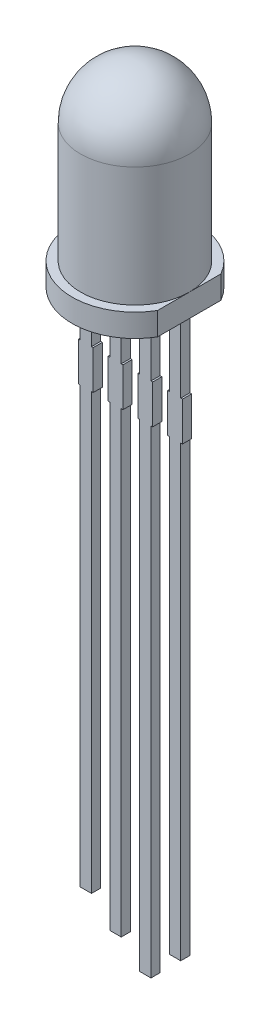
from build123d import *

# Parameters (mm, degrees)
SKETCH2_W           = 0.5
SKETCH2_H           = 24.3
SKETCH2_H_2         = 25.6
SKETCH2_H_3         = 24.7
SKETCH2_H_4         = 23.7
SKETCH2_W_2         = 0.65
SKETCH2_H_5         = 1.7
BOSS_EXTRUDE1_DEPTH = 0.2
CUT_EXTRUDE1_DEPTH  = 27.882801193


with BuildPart() as part:
    # Sketch1 → Revolve1 (revolve)
    with BuildSketch(Plane.XY, mode=Mode.PRIVATE) as revolve1_sk:
        with BuildLine():
            Line((0, 0), (2.75, 0))
            Line((2.75, 0), (2.75, 1))
            Line((2.75, 1), (2.375, 1))
            Line((2.375, 1), (2.375, 6.225))
            ThreePointArc((2.375, 6.225), (1.679378605, 7.904378605), (0, 8.6))
            Line((0, 8.6), (0, 0))
        make_face()
    revolve(revolve1_sk.sketch.rotate(Axis((0, 0, 0), (0, -1, 0)), 90), axis=Axis((0, 0, 0), (0, -1, 0)))

    # Sketch2 → Boss-Extrude1 (add, symmetric)
    with BuildSketch(Plane.XY):
        with Locations((1.95, -12.15)):
            Rectangle(SKETCH2_W, SKETCH2_H)
        with Locations((0.65, -12.8)):
            Rectangle(SKETCH2_W, SKETCH2_H_2)
        with Locations((-0.65, -12.35)):
            Rectangle(SKETCH2_W, SKETCH2_H_3)
        with Locations((-1.95, -11.85)):
            Rectangle(SKETCH2_W, SKETCH2_H_4)
        with Locations((-1.95, -3.85)):
            Rectangle(SKETCH2_W_2, SKETCH2_H_5)
        with Locations((-0.65, -3.85)):
            Rectangle(SKETCH2_W_2, SKETCH2_H_5)
        with Locations((0.65, -3.85)):
            Rectangle(SKETCH2_W_2, SKETCH2_H_5)
        with Locations((1.95, -3.85)):
            Rectangle(SKETCH2_W_2, SKETCH2_H_5)
    extrude(amount=BOSS_EXTRUDE1_DEPTH, both=True)

    # Sketch3 → Cut-Extrude1 (cut, through all)
    with BuildSketch(Plane(origin=(0, 1, 0), x_dir=(1, 0, 0), z_dir=(0, 1, 0))):
        Polygon((2.375, 24.558218042), (2.375, 1.386317063), (2.375, -1.386317063), (2.375, -24.558218042), (48.718801957, -24.558218042), (48.718801957, 24.558218042), align=None)
    extrude(amount=-CUT_EXTRUDE1_DEPTH, mode=Mode.SUBTRACT)


solid = part.part
